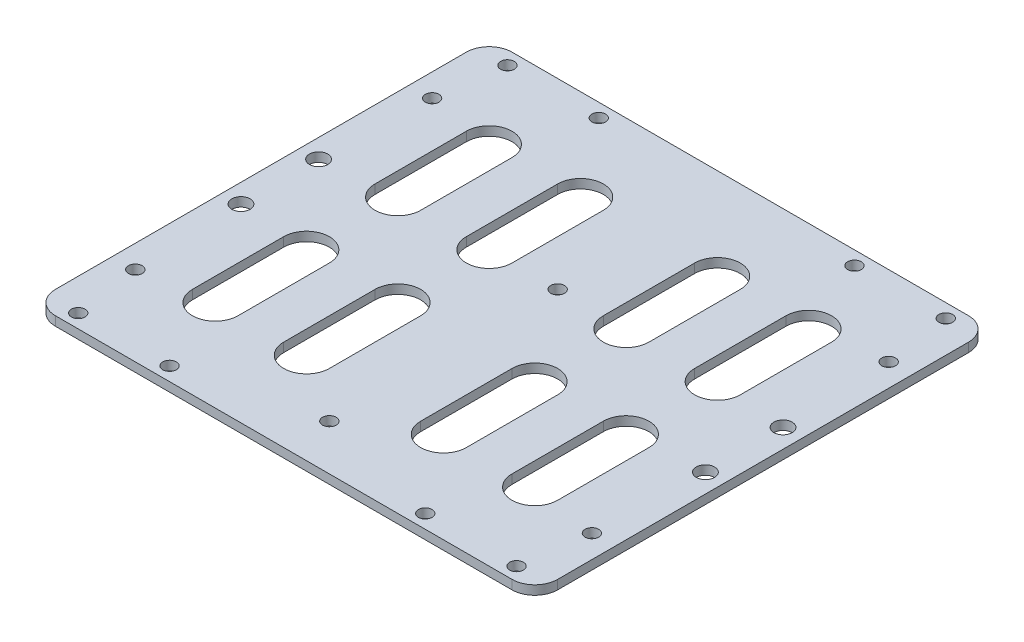
from build123d import *

# Parameters (mm, degrees)
SKETCH_1_W             = 110
SKETCH_1_H             = 100
SKETCH_1_R             = 1.5
SKETCH_1_R_2           = 2
EXTRUDE_1_DEPTH        = 2
FILLET_1_R             = 5
SKETCH_2_R             = 1.5
CUT_EXTRUDE_1129_DEPTH = 10
CUT_EXTRUDE_1751_DEPTH = 10
SKETCH_4_R             = 1.5
CUT_EXTRUDE_1991_DEPTH = 10


with BuildPart() as part:
    # 草图1 → 凸台-拉伸1 (new body)
    with BuildSketch(Plane(origin=(0, 0, 0), x_dir=(1, 0, 0), z_dir=(0, 1, 0))):
        Rectangle(SKETCH_1_W, SKETCH_1_H)
        with Locations(Location((-48, -47, 0), (0, 0, 270))):
            Circle(SKETCH_1_R, mode=Mode.SUBTRACT)
        with Locations(Location((-28, -47, 0), (0, 0, 270))):
            Circle(SKETCH_1_R, mode=Mode.SUBTRACT)
        with Locations(Location((28, -47, 0), (0, 0, 90))):
            Circle(SKETCH_1_R, mode=Mode.SUBTRACT)
        with Locations(Location((48, -47, 0), (0, 0, 90))):
            Circle(SKETCH_1_R, mode=Mode.SUBTRACT)
        with Locations(Location((-50.854561817, 8.5, 0), (0, 0, 270))):
            Circle(SKETCH_1_R_2, mode=Mode.SUBTRACT)
        with Locations(Location((-50.854561817, -8.5, 0), (0, 0, 270))):
            Circle(SKETCH_1_R_2, mode=Mode.SUBTRACT)
        with Locations(Location((50.854561817, -8.5, 0), (0, 0, 90))):
            Circle(SKETCH_1_R_2, mode=Mode.SUBTRACT)
        with Locations(Location((50.854561817, 8.5, 0), (0, 0, 90))):
            Circle(SKETCH_1_R_2, mode=Mode.SUBTRACT)
        with Locations(Location((48, 47, 0), (0, 0, 270))):
            Circle(SKETCH_1_R, mode=Mode.SUBTRACT)
        with Locations(Location((28, 47, 0), (0, 0, 270))):
            Circle(SKETCH_1_R, mode=Mode.SUBTRACT)
        with Locations(Location((-28, 47, 0), (0, 0, 90))):
            Circle(SKETCH_1_R, mode=Mode.SUBTRACT)
        with Locations(Location((-48, 47, 0), (0, 0, 90))):
            Circle(SKETCH_1_R, mode=Mode.SUBTRACT)
    extrude(amount=EXTRUDE_1_DEPTH)

    # 圆角1
    fillet_1_edges = [part.edges().sort_by_distance(p)[0] for p in [
        (55, 1, 50),
        (-55, 1, 50),
        (-55, 1, -50),
        (55, 1, -50),
    ]]
    fillet(fillet_1_edges, radius=FILLET_1_R)

    # 草图2 → Cut-Extrude 1129 (cut)
    with BuildSketch(Plane(origin=(0, 2, 0), x_dir=(1, 0, 0), z_dir=(0, 1, 0))):
        with Locations(Location((0, 10, 0), (0, 0, 270))):
            Circle(SKETCH_2_R)
        with Locations(Location((0, -40, 0), (0, 0, 270))):
            Circle(SKETCH_2_R)
    extrude(amount=-CUT_EXTRUDE_1129_DEPTH, mode=Mode.SUBTRACT)

    # 草图3 → Cut-Extrude 1751 (cut)
    with BuildSketch(Plane.XZ):
        with BuildLine():
            Line((30, -30), (30, -10))
            ThreePointArc((30, -10), (35, -5), (40, -10))
            Line((40, -10), (40, -30))
            ThreePointArc((40, -30), (35, -35), (30, -30))
        make_face()
        with BuildLine():
            Line((10, -30), (10, -10))
            ThreePointArc((10, -10), (15, -5), (20, -10))
            Line((20, -10), (20, -30))
            ThreePointArc((20, -30), (15, -35), (10, -30))
        make_face()
        with BuildLine():
            Line((30, 30), (30, 10))
            ThreePointArc((30, 10), (35, 5), (40, 10))
            Line((40, 10), (40, 30))
            ThreePointArc((40, 30), (35, 35), (30, 30))
        make_face()
        with BuildLine():
            Line((10, 30), (10, 10))
            ThreePointArc((10, 10), (15, 5), (20, 10))
            Line((20, 10), (20, 30))
            ThreePointArc((20, 30), (15, 35), (10, 30))
        make_face()
        with BuildLine():
            Line((-30, -30), (-30, -10))
            ThreePointArc((-30, -10), (-35, -5), (-40, -10))
            Line((-40, -10), (-40, -30))
            ThreePointArc((-40, -30), (-35, -35), (-30, -30))
        make_face()
        with BuildLine():
            Line((-10, -30), (-10, -10))
            ThreePointArc((-10, -10), (-15, -5), (-20, -10))
            Line((-20, -10), (-20, -30))
            ThreePointArc((-20, -30), (-15, -35), (-10, -30))
        make_face()
        with BuildLine():
            Line((-30, 30), (-30, 10))
            ThreePointArc((-30, 10), (-35, 5), (-40, 10))
            Line((-40, 10), (-40, 30))
            ThreePointArc((-40, 30), (-35, 35), (-30, 30))
        make_face()
        with BuildLine():
            Line((-10, 30), (-10, 10))
            ThreePointArc((-10, 10), (-15, 5), (-20, 10))
            Line((-20, 10), (-20, 30))
            ThreePointArc((-20, 30), (-15, 35), (-10, 30))
        make_face()
    extrude(amount=-CUT_EXTRUDE_1751_DEPTH, mode=Mode.SUBTRACT)

    # 草图4 → Cut-Extrude 1991 (cut)
    with BuildSketch(Plane.XZ):
        with Locations(Location((50, 32.5, 0), (0, 0, 270))):
            Circle(SKETCH_4_R)
        with Locations(Location((-50, 32.5, 0), (0, 0, 90))):
            Circle(SKETCH_4_R)
        with Locations(Location((-50, -32.5, 0), (0, 0, 270))):
            Circle(SKETCH_4_R)
        with Locations(Location((50, -32.5, 0), (0, 0, 90))):
            Circle(SKETCH_4_R)
    extrude(amount=-CUT_EXTRUDE_1991_DEPTH, mode=Mode.SUBTRACT)


solid = part.part
